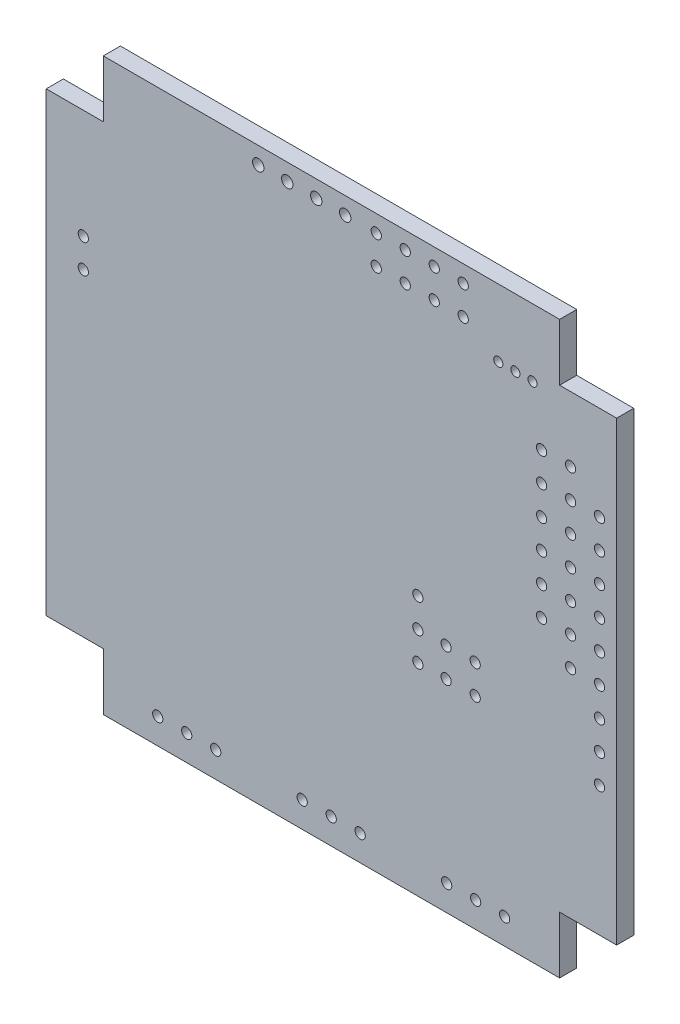
from build123d import *

# Parameters (mm, degrees)
SKETCH_3_R      = 0.4499991
SKETCH_3_R_2    = 0.3999992
SKETCH_3_R_3    = 0.499999
EXTRUDE_1_DEPTH = 1.5


with BuildPart() as part:
    # Эскиз3 → Бобышка-Вытянуть1 (new body)
    with BuildSketch(Plane.XY):
        Polygon((24.081237265, -17.758826004), (24.081237265, 22.241173056), (19.081237265, 22.241173056), (19.081237265, 27.241173056), (-20.918761795, 27.241173056), (-20.918761795, 22.241173056), (-25.918761795, 22.241173056), (-25.918761795, -17.758826004), (-20.918761795, -17.758826004), (-20.918761795, -22.758826004), (19.081237265, -22.758826004), (19.081237265, -17.758826004), align=None)
        with Locations((22.581258045, 1.241166636)):
            Circle(SKETCH_3_R, mode=Mode.SUBTRACT)
        with Locations((22.581258045, 3.791174236)):
            Circle(SKETCH_3_R, mode=Mode.SUBTRACT)
        with Locations((22.581258045, 6.341181836)):
            Circle(SKETCH_3_R, mode=Mode.SUBTRACT)
        with Locations((22.581258045, 8.891189436)):
            Circle(SKETCH_3_R, mode=Mode.SUBTRACT)
        with Locations((22.581258045, 11.441197036)):
            Circle(SKETCH_3_R, mode=Mode.SUBTRACT)
        with Locations((22.581258045, 13.991204636)):
            Circle(SKETCH_3_R, mode=Mode.SUBTRACT)
        with Locations((17.501258045, 3.791174236)):
            Circle(SKETCH_3_R, mode=Mode.SUBTRACT)
        with Locations((17.501258045, 6.341181836)):
            Circle(SKETCH_3_R, mode=Mode.SUBTRACT)
        with Locations((17.501258045, 8.891189436)):
            Circle(SKETCH_3_R, mode=Mode.SUBTRACT)
        with Locations((17.501258045, 11.441197036)):
            Circle(SKETCH_3_R, mode=Mode.SUBTRACT)
        with Locations((17.501258045, 13.991204636)):
            Circle(SKETCH_3_R, mode=Mode.SUBTRACT)
        with Locations((17.501258045, 16.541212236)):
            Circle(SKETCH_3_R, mode=Mode.SUBTRACT)
        with Locations((20.041258045, 16.541212236)):
            Circle(SKETCH_3_R, mode=Mode.SUBTRACT)
        with Locations((20.041258045, 13.991204636)):
            Circle(SKETCH_3_R, mode=Mode.SUBTRACT)
        with Locations((20.041258045, 11.441197036)):
            Circle(SKETCH_3_R, mode=Mode.SUBTRACT)
        with Locations((20.041258045, 8.891189436)):
            Circle(SKETCH_3_R, mode=Mode.SUBTRACT)
        with Locations((20.041258045, 6.341181836)):
            Circle(SKETCH_3_R, mode=Mode.SUBTRACT)
        with Locations((20.041258045, 3.791174236)):
            Circle(SKETCH_3_R, mode=Mode.SUBTRACT)
        with Locations((20.041258045, 1.241166636)):
            Circle(SKETCH_3_R, mode=Mode.SUBTRACT)
        with Locations((22.581235185, -6.388825724)):
            Circle(SKETCH_3_R, mode=Mode.SUBTRACT)
        with Locations((22.581235185, -3.848825724)):
            Circle(SKETCH_3_R, mode=Mode.SUBTRACT)
        with Locations((22.581235185, -1.308825724)):
            Circle(SKETCH_3_R, mode=Mode.SUBTRACT)
        with Locations((3.011236225, 25.741170976)):
            Circle(SKETCH_3_R, mode=Mode.SUBTRACT)
        with Locations((5.551236225, 23.201170976)):
            Circle(SKETCH_3_R, mode=Mode.SUBTRACT)
        with Locations((5.551236225, 25.741170976)):
            Circle(SKETCH_3_R, mode=Mode.SUBTRACT)
        with Locations((8.091236225, 23.201170976)):
            Circle(SKETCH_3_R, mode=Mode.SUBTRACT)
        with Locations((8.091236225, 25.741170976)):
            Circle(SKETCH_3_R, mode=Mode.SUBTRACT)
        with Locations((10.631236225, 25.741170976)):
            Circle(SKETCH_3_R, mode=Mode.SUBTRACT)
        with Locations((10.631236225, 23.201170976)):
            Circle(SKETCH_3_R, mode=Mode.SUBTRACT)
        with Locations((13.706236425, 21.341172156)):
            Circle(SKETCH_3_R_2, mode=Mode.SUBTRACT)
        with Locations((15.206235965, 21.341172156)):
            Circle(SKETCH_3_R_2, mode=Mode.SUBTRACT)
        with Locations((16.706235505, 21.341172156)):
            Circle(SKETCH_3_R_2, mode=Mode.SUBTRACT)
        with Locations((6.656270845, 0.041156336)):
            Circle(SKETCH_3_R, mode=Mode.SUBTRACT)
        with Locations((6.656270845, -5.038843664)):
            Circle(SKETCH_3_R, mode=Mode.SUBTRACT)
        with Locations((6.656270845, -2.498843664)):
            Circle(SKETCH_3_R, mode=Mode.SUBTRACT)
        with Locations((9.131325585, -2.498843664)):
            Circle(SKETCH_3_R, mode=Mode.SUBTRACT)
        with Locations((9.131325585, -5.038843664)):
            Circle(SKETCH_3_R, mode=Mode.SUBTRACT)
        with Locations((11.681361125, -2.498843664)):
            Circle(SKETCH_3_R, mode=Mode.SUBTRACT)
        with Locations((14.261284845, -20.508802564)):
            Circle(SKETCH_3_R, mode=Mode.SUBTRACT)
        with Locations((11.721284845, -20.508802564)):
            Circle(SKETCH_3_R, mode=Mode.SUBTRACT)
        with Locations((9.181284845, -20.508802564)):
            Circle(SKETCH_3_R, mode=Mode.SUBTRACT)
        with Locations((1.598775245, -20.508802564)):
            Circle(SKETCH_3_R, mode=Mode.SUBTRACT)
        with Locations((-0.941224755, -20.508802564)):
            Circle(SKETCH_3_R, mode=Mode.SUBTRACT)
        with Locations((-3.481224755, -20.508802564)):
            Circle(SKETCH_3_R, mode=Mode.SUBTRACT)
        with Locations((-11.063734355, -20.508802564)):
            Circle(SKETCH_3_R, mode=Mode.SUBTRACT)
        with Locations((-13.603734355, -20.508802564)):
            Circle(SKETCH_3_R, mode=Mode.SUBTRACT)
        with Locations((-16.143734355, -20.508802564)):
            Circle(SKETCH_3_R, mode=Mode.SUBTRACT)
        with Locations((-22.668758135, 10.141171696)):
            Circle(SKETCH_3_R, mode=Mode.SUBTRACT)
        with Locations((-22.668758135, 12.681171696)):
            Circle(SKETCH_3_R, mode=Mode.SUBTRACT)
        with Locations((-7.333782455, 25.756172216)):
            Circle(SKETCH_3_R_3, mode=Mode.SUBTRACT)
        with Locations((-4.793782455, 25.756172216)):
            Circle(SKETCH_3_R_3, mode=Mode.SUBTRACT)
        with Locations((-2.253782455, 25.756172216)):
            Circle(SKETCH_3_R_3, mode=Mode.SUBTRACT)
        with Locations((0.286217545, 25.756172216)):
            Circle(SKETCH_3_R_3, mode=Mode.SUBTRACT)
        with Locations((3.011236225, 23.201170976)):
            Circle(SKETCH_3_R, mode=Mode.SUBTRACT)
        with Locations((11.681361125, -5.038843664)):
            Circle(SKETCH_3_R, mode=Mode.SUBTRACT)
    extrude(amount=EXTRUDE_1_DEPTH)


solid = part.part
